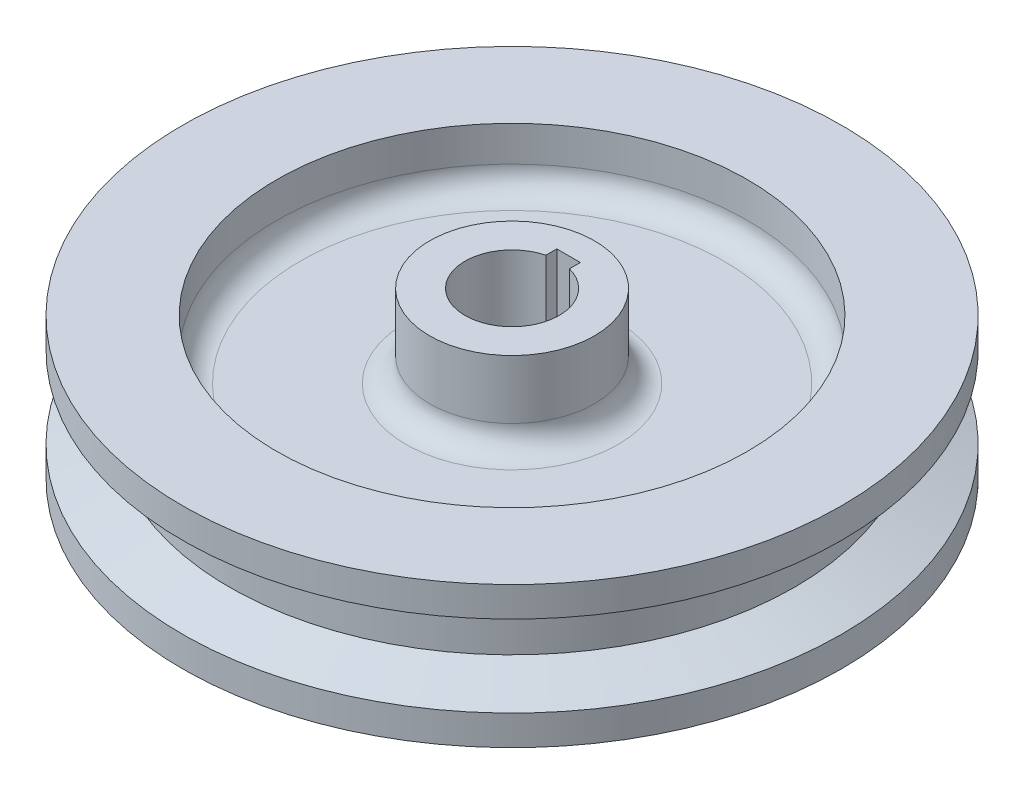
from build123d import *

# Parameters (mm, degrees)
SKETCH2_W          = 6.35
SKETCH2_H          = 15.24
CUT_EXTRUDE1_DEPTH = 50.8


with BuildPart() as part:
    # Sketch1 → Revolve1 (revolve)
    with BuildSketch(Plane.XY):
        with BuildLine():
            Line((12.7, 25.4), (22.225, 25.4))
            Line((22.225, 25.4), (22.225, 9.525))
            ThreePointArc((22.225, 9.525), (24.084871939, 5.034871939), (28.575, 3.175))
            Line((28.575, 3.175), (57.15, 3.175))
            ThreePointArc((57.15, 3.175), (61.640128061, 5.034871939), (63.5, 9.525))
            Line((63.5, 9.525), (63.5, 19.05))
            Line((63.5, 19.05), (88.9, 19.05))
            Line((88.9, 19.05), (88.9, 10.972421975))
            Line((88.9, 10.972421975), (76.2, 6.35))
            Line((76.2, 6.35), (76.2, -6.35))
            Line((76.2, -6.35), (88.9, -10.972421975))
            Line((88.9, -10.972421975), (88.9, -19.05))
            Line((88.9, -19.05), (63.5, -19.05))
            Line((63.5, -19.05), (63.5, -9.525))
            ThreePointArc((63.5, -9.525), (61.640128061, -5.034871939), (57.15, -3.175))
            Line((57.15, -3.175), (28.575, -3.175))
            ThreePointArc((28.575, -3.175), (24.084871939, -5.034871939), (22.225, -9.525))
            Line((22.225, -9.525), (22.225, -25.4))
            Line((22.225, -25.4), (12.7, -25.4))
            Line((12.7, -25.4), (12.7, 25.4))
        make_face()
    revolve(axis=Axis((0, -1000, 0), (0, 1, 0)))

    # Sketch2 → Cut-Extrude1 (cut)
    with BuildSketch(Plane(origin=(0, 25.4, 0), x_dir=(1, 0, 0), z_dir=(0, 1, 0))):
        with Locations((0, 7.62)):
            Rectangle(SKETCH2_W, SKETCH2_H)
    extrude(amount=-CUT_EXTRUDE1_DEPTH, mode=Mode.SUBTRACT)


solid = part.part
